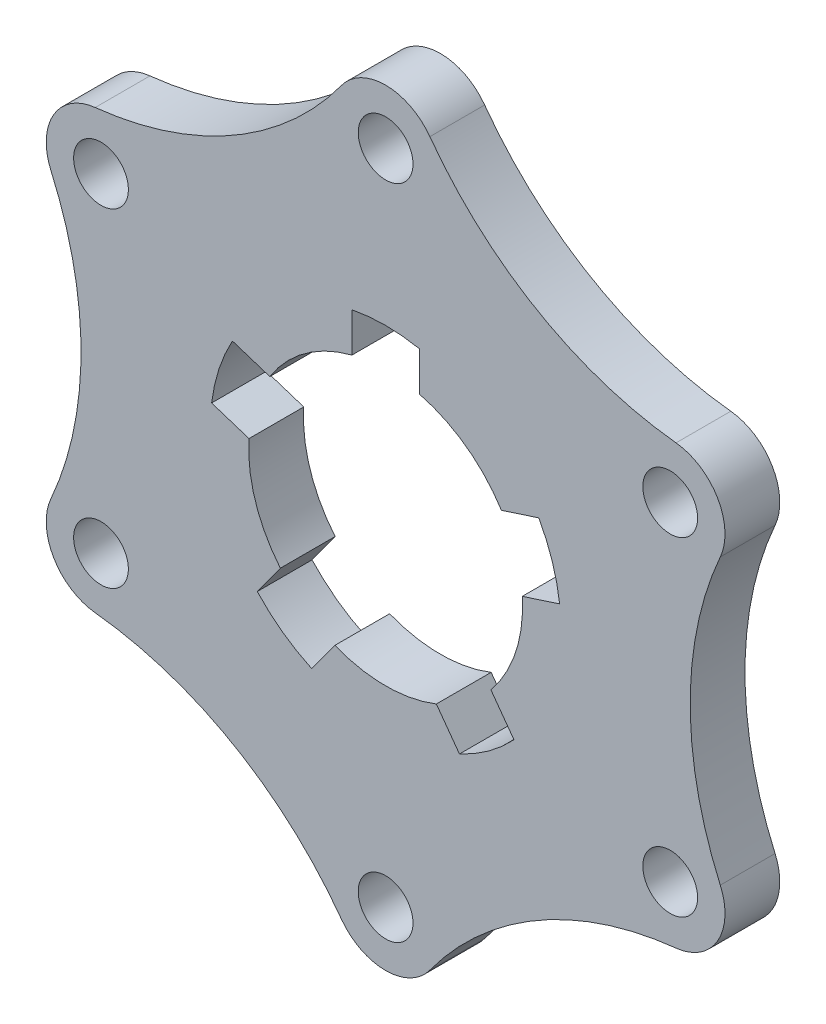
from build123d import *

# Parameters (mm, degrees)
SALIENTE_EXTRUIR1_DEPTH = 10
CROQUIS2_R              = 5
CORTAR_EXTRUIR3_DEPTH   = 95.017181858


with BuildPart() as part:
    # Croquis1 → Saliente-Extruir1 (new body)
    with BuildSketch(Plane.XY):
        with BuildLine():
            ThreePointArc((8.081598806, 65.88963163), (0, 70), (-8.081598806, 65.88963163))
            ThreePointArc((-8.081598806, 65.88963163), (-27.803831164, 48.157648221), (-53.021295435, 39.943685684))
            ThreePointArc((-53.021295435, 39.943685684), (-60.621778265, 35), (-61.102894241, 25.945945946))
            ThreePointArc((-61.102894241, 25.945945946), (-55.607662328, 0), (-61.102894241, -25.945945946))
            ThreePointArc((-61.102894241, -25.945945946), (-60.621778265, -35), (-53.021295435, -39.943685684))
            ThreePointArc((-53.021295435, -39.943685684), (-27.803831164, -48.157648221), (-8.081598806, -65.88963163))
            ThreePointArc((-8.081598806, -65.88963163), (0, -70), (8.081598806, -65.88963163))
            ThreePointArc((8.081598806, -65.88963163), (27.803831164, -48.157648221), (53.021295435, -39.943685684))
            ThreePointArc((53.021295435, -39.943685684), (60.621778265, -35), (61.102894241, -25.945945946))
            ThreePointArc((61.102894241, -25.945945946), (55.607662328, 0), (61.102894241, 25.945945946))
            ThreePointArc((61.102894241, 25.945945946), (60.621778265, 35), (53.021295435, 39.943685684))
            ThreePointArc((53.021295435, 39.943685684), (27.803831164, 48.157648221), (8.081598806, 65.88963163))
        make_face()
    extrude(amount=-SALIENTE_EXTRUIR1_DEPTH)

    # Croquis2 → Cortar-Extruir3 (cut, through all)
    with BuildSketch(Plane.XY):
        with Locations((0, 60)):
            Circle(CROQUIS2_R)
        with Locations((51.961524227, 30)):
            Circle(CROQUIS2_R)
        with Locations((51.961524227, -30)):
            Circle(CROQUIS2_R)
        with Locations((0, -60)):
            Circle(CROQUIS2_R)
        with Locations((-51.961524227, -30)):
            Circle(CROQUIS2_R)
        with Locations((-51.961524227, 30)):
            Circle(CROQUIS2_R)
        with BuildLine():
            Line((24.946214171, 1.639023652), (31.766922812, 3.855206231))
            ThreePointArc((31.766922812, 3.855206231), (30.433808521, 9.88854382), (27.966013781, 15.553201382))
            Line((27.966013781, 15.553201382), (21.14530514, 13.337018802))
            ThreePointArc((21.14530514, 13.337018802), (14.694631307, 20.225424859), (6.15, 24.231745707))
            Line((6.15, 24.231745707), (6.15, 31.403463185))
            ThreePointArc((6.15, 31.403463185), (0, 32), (-6.15, 31.403463185))
            Line((-6.15, 31.403463185), (-6.15, 24.231745707))
            ThreePointArc((-6.15, 24.231745707), (-14.694631307, 20.225424859), (-21.14530514, 13.337018802))
            Line((-21.14530514, 13.337018802), (-27.966013781, 15.553201382))
            ThreePointArc((-27.966013781, 15.553201382), (-30.433808521, 9.88854382), (-31.766922812, 3.855206231))
            Line((-31.766922812, 3.855206231), (-24.946214171, 1.639023652))
            ThreePointArc((-24.946214171, 1.639023652), (-23.776412907, -7.725424859), (-19.218517279, -15.989014779))
            Line((-19.218517279, -15.989014779), (-23.433947046, -21.791056097))
            ThreePointArc((-23.433947046, -21.791056097), (-18.809128073, -25.88854382), (-13.483038016, -29.0208147))
            Line((-13.483038016, -29.0208147), (-9.267608248, -23.218773382))
            ThreePointArc((-9.267608248, -23.218773382), (0, -25), (9.267608248, -23.218773382))
            Line((9.267608248, -23.218773382), (13.483038016, -29.0208147))
            ThreePointArc((13.483038016, -29.0208147), (18.809128073, -25.88854382), (23.433947046, -21.791056097))
            Line((23.433947046, -21.791056097), (19.218517279, -15.989014779))
            ThreePointArc((19.218517279, -15.989014779), (23.776412907, -7.725424859), (24.946214171, 1.639023652))
        make_face()
    extrude(amount=-CORTAR_EXTRUIR3_DEPTH, mode=Mode.SUBTRACT)


solid = part.part
